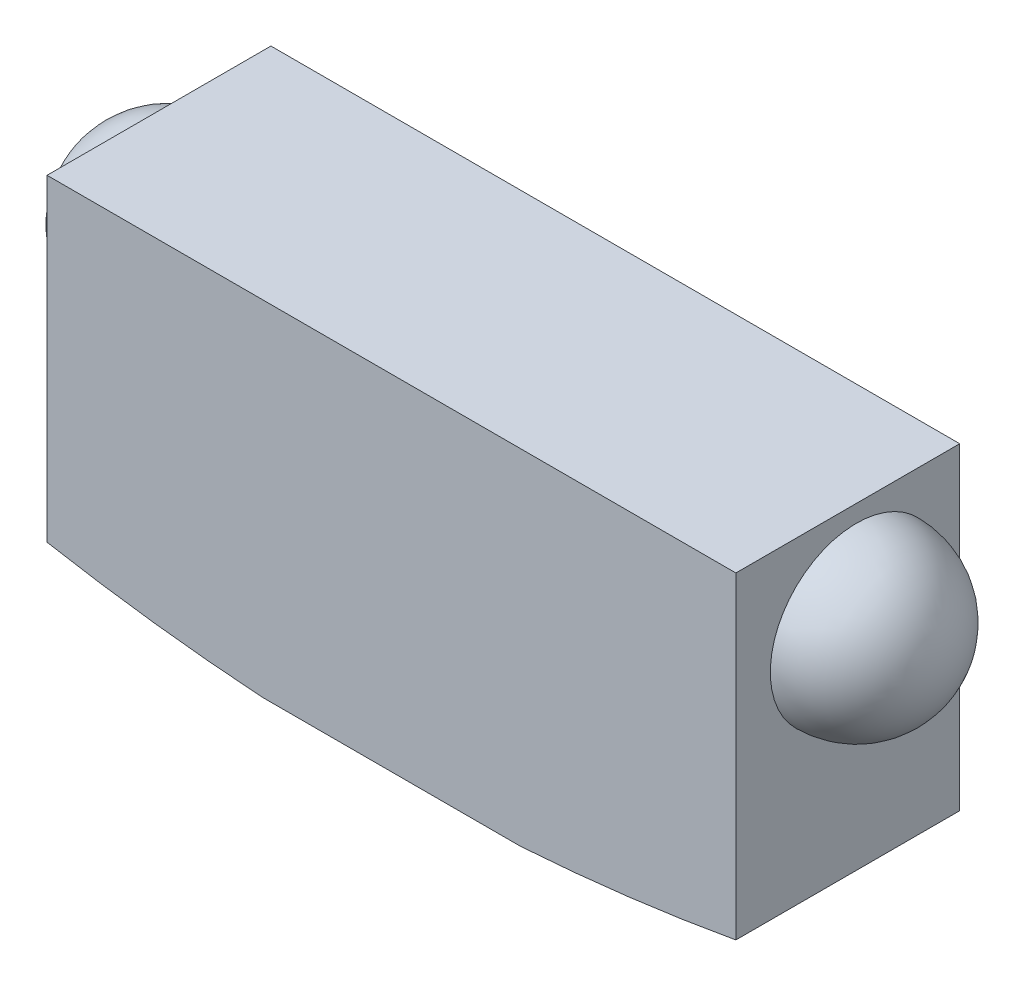
from build123d import *

# Parameters (mm, degrees)
BOSS_EXTRUDE1_DEPTH      = 50
BOSS_EXTRUDE1_DEPTH_BACK = 50
SKETCH2_W                = 200
SKETCH2_H                = 130
SKETCH4_R                = 5
BOSS_EXTRUDE2_DEPTH      = 20
CUT_EXTRUDE1_DEPTH       = 142
SKETCH8_W                = 200.147061324
SKETCH8_H                = 101.72915409
CUT_EXTRUDE2_DEPTH       = 142


with BuildPart() as part:
    # Sketch2 → Boss-Extrude1 (new, two sides: drawn at the far end of the back side and taken through both)
    with BuildSketch(Plane(origin=(0, 0, 0), x_dir=(1, 0, 0), z_dir=(0, 1, 0)).offset(-BOSS_EXTRUDE1_DEPTH_BACK)):
        Rectangle(SKETCH2_W, SKETCH2_H)
    extrude(amount=BOSS_EXTRUDE1_DEPTH + BOSS_EXTRUDE1_DEPTH_BACK)

    # Sketch4 → Boss-Extrude2 (add)
    with BuildSketch(Plane.XY.offset(65)):
        Circle(SKETCH4_R)
    extrude(amount=BOSS_EXTRUDE2_DEPTH)

    # Sketch6 → Revolve1 (revolve)
    with BuildSketch(Plane.ZY.offset(100)):
        with BuildLine():
            Line((-35, -5), (-35, 45))
            ThreePointArc((-35, 45), (-10, 20), (-35, -5))
        make_face()
    revolve1 = revolve(axis=Axis((-100, -5, -35), (0, 1, 0)))

    # Mirror1: Revolve1 across plane
    add(revolve1.mirror(Plane(origin=(0, 0, 0), x_dir=(0, 0, 1), z_dir=(1, 0, 0))))

    # Sketch7 → Cut-Extrude1 (cut)
    with BuildSketch(Plane(origin=(0, 0, -65), x_dir=(-1, 0, 0), z_dir=(0, 0, -1))):
        with BuildLine():
            ThreePointArc((-37.519288456, -50), (-68.867740428, -47.018454326), (-100, -42.285857823))
            Line((-100, -42.285857823), (-100, -50))
            Line((-100, -50), (-37.519288456, -50))
        make_face()
        with BuildLine():
            Line((100, -50), (100, -42.285857823))
            ThreePointArc((100, -42.285857823), (68.867740428, -47.018454326), (37.519288456, -50))
            Line((37.519288456, -50), (100, -50))
        make_face()
    extrude(amount=-CUT_EXTRUDE1_DEPTH, mode=Mode.SUBTRACT)

    # Sketch8 → Cut-Extrude2 (cut)
    with BuildSketch(Plane(origin=(0, 50, 0), x_dir=(1, 0, 0), z_dir=(0, 1, 0))):
        with Locations((0.073530662, -50.864577045)):
            Rectangle(SKETCH8_W, SKETCH8_H)
    extrude(amount=-CUT_EXTRUDE2_DEPTH, mode=Mode.SUBTRACT)


solid = part.part
